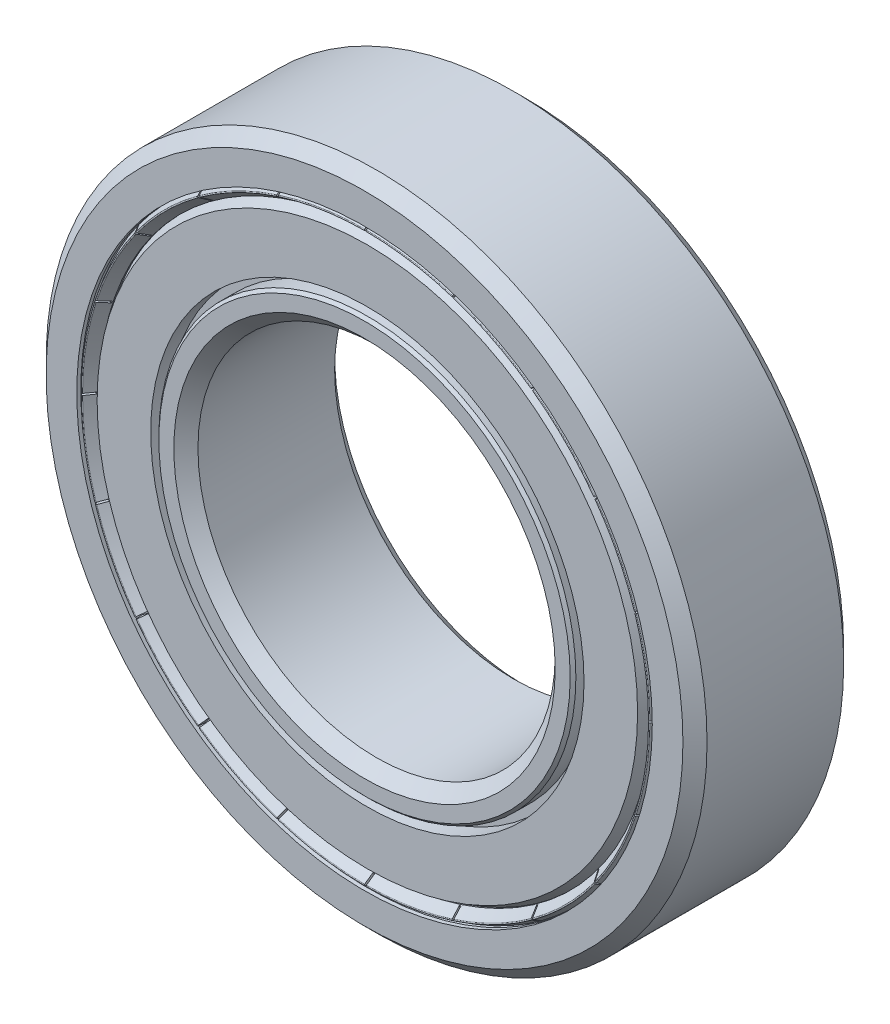
from build123d import *

# Parameters (mm, degrees)
CIRPATTERN1_COUNT  = 10
FILLET1_R          = 0.045
CUT_EXTRUDE1_START = 3.92899
CUT_EXTRUDE1_DEPTH = 23.618137905
CIRPATTERN2_COUNT  = 20


with BuildPart() as part:
    # Sketch3 → Revolve1 (revolve)
    with BuildSketch(Plane(origin=(0, 0, 0), x_dir=(0, 0, -1), z_dir=(1, 0, 0)), mode=Mode.PRIVATE) as revolve1_sk:
        with BuildLine():
            Line((3.825, 18.5), (-3.825, 18.5))
            Line((-3.825, 18.5), (-4.5, 17.825))
            Line((-4.5, 17.825), (-4.5, 16.109653101))
            Line((-4.5, 16.109653101), (-4.275, 16.109653101))
            Line((-4.275, 16.109653101), (-4.275, 16.66732655))
            Line((-4.275, 16.66732655), (-4.115900974, 16.826425576))
            Line((-4.115900974, 16.826425576), (-1.4875, 16.826425576))
            ThreePointArc((-1.4875, 16.826425576), (0, 17.225), (1.4875, 16.826425576))
            Line((1.4875, 16.826425576), (4.115900974, 16.826425576))
            Line((4.115900974, 16.826425576), (4.275, 16.66732655))
            Line((4.275, 16.66732655), (4.275, 16.109653101))
            Line((4.275, 16.109653101), (4.5, 16.109653101))
            Line((4.5, 16.109653101), (4.5, 17.825))
            Line((4.5, 17.825), (3.825, 18.5))
        make_face()
        with BuildLine():
            Line((3.825, 10), (-3.825, 10))
            Line((-3.825, 10), (-4.5, 10.675))
            Line((-4.5, 10.675), (-4.5, 11.514475398))
            Line((-4.5, 11.514475398), (-4.340900974, 11.673574424))
            Line((-4.340900974, 11.673574424), (-1.4875, 11.673574424))
            ThreePointArc((-1.4875, 11.673574424), (0, 11.275), (1.4875, 11.673574424))
            Line((1.4875, 11.673574424), (4.340900974, 11.673574424))
            Line((4.340900974, 11.673574424), (4.5, 11.514475398))
            Line((4.5, 11.514475398), (4.5, 10.675))
            Line((4.5, 10.675), (3.825, 10))
        make_face()
    revolve(revolve1_sk.sketch.rotate(Axis((0, 0, 4.5), (0, 0, -1)), 90), axis=Axis((0, 0, 4.5), (0, 0, -1)))


with BuildPart() as body_2:
    # Sketch4 → Revolve2 (revolve)
    with BuildSketch(Plane(origin=(0, 0, 0), x_dir=(0, 0, -1), z_dir=(1, 0, 0))):
        with BuildLine():
            Line((0, 17.225), (0, 11.275))
            ThreePointArc((0, 11.275), (-2.975, 14.25), (0, 17.225))
        make_face()
    revolve(axis=Axis((0, 18.5, 0), (0, -1, 0)))


with BuildPart() as cirpattern1_1:
    # CirPattern1: pattern copy
    add(body_2.part.rotate(Axis((0, 0, 0), (0, 0, 1)), 1 * 360 / CIRPATTERN1_COUNT))


with BuildPart() as cirpattern1_2:
    # CirPattern1: pattern copy
    add(body_2.part.rotate(Axis((0, 0, 0), (0, 0, 1)), 2 * 360 / CIRPATTERN1_COUNT))


with BuildPart() as cirpattern1_3:
    # CirPattern1: pattern copy
    add(body_2.part.rotate(Axis((0, 0, 0), (0, 0, 1)), 3 * 360 / CIRPATTERN1_COUNT))


with BuildPart() as cirpattern1_4:
    # CirPattern1: pattern copy
    add(body_2.part.rotate(Axis((0, 0, 0), (0, 0, 1)), 4 * 360 / CIRPATTERN1_COUNT))


with BuildPart() as cirpattern1_5:
    # CirPattern1: pattern copy
    add(body_2.part.rotate(Axis((0, 0, 0), (0, 0, 1)), 5 * 360 / CIRPATTERN1_COUNT))


with BuildPart() as cirpattern1_6:
    # CirPattern1: pattern copy
    add(body_2.part.rotate(Axis((0, 0, 0), (0, 0, 1)), 6 * 360 / CIRPATTERN1_COUNT))


with BuildPart() as cirpattern1_7:
    # CirPattern1: pattern copy
    add(body_2.part.rotate(Axis((0, 0, 0), (0, 0, 1)), 7 * 360 / CIRPATTERN1_COUNT))


with BuildPart() as cirpattern1_8:
    # CirPattern1: pattern copy
    add(body_2.part.rotate(Axis((0, 0, 0), (0, 0, 1)), 8 * 360 / CIRPATTERN1_COUNT))


with BuildPart() as cirpattern1_9:
    # CirPattern1: pattern copy
    add(body_2.part.rotate(Axis((0, 0, 0), (0, 0, 1)), 9 * 360 / CIRPATTERN1_COUNT))


with BuildPart() as body_12:
    # Sketch5 → Revolve3 (revolve)
    with BuildSketch(Plane(origin=(0, 0, 0), x_dir=(0, 0, -1), z_dir=(1, 0, 0)), mode=Mode.PRIVATE) as revolve3_sk:
        Polygon((-2.975, 11.673574424), (-3.430300325, 11.673574424), (-3.430300325, 12.128874748), (-4.340900974, 12.128874748), (-4.340900974, 15.128617246), (-3.430300325, 15.654352776), (-2.975, 15.654352776), align=None)
        Polygon((3.430300325, 15.654352776), (2.975, 15.654352776), (2.975, 11.673574424), (3.430300325, 11.673574424), (3.430300325, 12.128874748), (4.340900974, 12.128874748), (4.340900974, 15.128617246), align=None)
    revolve(revolve3_sk.sketch.rotate(Axis((0, 0, 4.5), (0, 0, -1)), 90), axis=Axis((0, 0, 4.5), (0, 0, -1)))


with BuildPart() as body_13:
    # Sketch6 → Revolve4 (revolve)
    with BuildSketch(Plane(origin=(0, 0, 0), x_dir=(0, 0, -1), z_dir=(1, 0, 0)), mode=Mode.PRIVATE) as revolve4_sk:
        Polygon((-3.751730535, 16.109653101), (-4.10625, 16.109653101), (-4.5, 15.882321432), (-3.886730535, 15.45290553), (-3.841730535, 15.45290553), (-3.751730535, 15.468774958), align=None)
    revolve(revolve4_sk.sketch.rotate(Axis((0, 0, 4.5), (0, 0, -1)), 90), axis=Axis((0, 0, 4.5), (0, 0, -1)))

    # Fillet1
    fillet1_edges = [body_13.edges().sort_by_distance(p)[0] for p in [
        (-15.882321432, 0, 4.5),
    ]]
    fillet(fillet1_edges, radius=FILLET1_R)

    # Sketch7 → Cut-Extrude1 (cut, through all)
    with BuildSketch(Plane.XY.offset(CUT_EXTRUDE1_START)):
        Polygon((-0.05, 16.109653101), (-0.05, 16.209653101), (0.05, 16.209653101), (0.05, 16.109653101), (0.05, 15.45290553), (0.05, 15.35290553), (-0.05, 15.35290553), (-0.05, 15.45290553), align=None)
    cut_extrude1 = extrude(amount=CUT_EXTRUDE1_DEPTH, mode=Mode.SUBTRACT)

    # CirPattern2: Cut-Extrude1 ×20 about axis
    cirpattern2_axis = Axis((0, 0, 0), (0, 0, 1))
    for i in range(1, CIRPATTERN2_COUNT):
        add(cut_extrude1.rotate(cirpattern2_axis, i * 360 / CIRPATTERN2_COUNT), mode=Mode.SUBTRACT)


with BuildPart() as body_14:
    # Mirror1: mirrored copy
    add(body_13.part.mirror(Plane.XY))


solid = Compound([part.part, body_2.part, cirpattern1_1.part, cirpattern1_2.part, cirpattern1_3.part, cirpattern1_4.part, cirpattern1_5.part, cirpattern1_6.part, cirpattern1_7.part, cirpattern1_8.part, cirpattern1_9.part, body_12.part, body_13.part, body_14.part])
